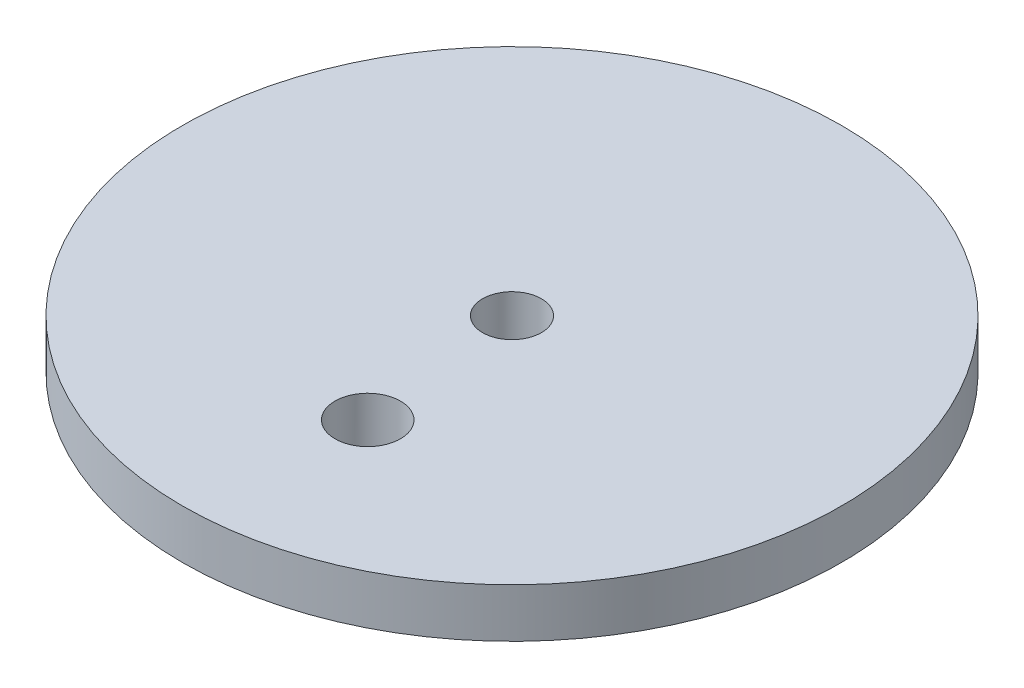
from build123d import *

# Parameters (mm, degrees)
SKETCH1_W          = 18.364886743
SKETCH1_H          = 3
SKETCH2_R          = 2.003106167
CUT_EXTRUDE1_DEPTH = 10


with BuildPart() as part:
    # Sketch1 → Revolve1 (revolve)
    with BuildSketch(Plane.XY, mode=Mode.PRIVATE) as revolve1_sk:
        with Locations((10.982443372, 7.898101992)):
            Rectangle(SKETCH1_W, SKETCH1_H)
    revolve(revolve1_sk.sketch.rotate(Axis((0, 9.398101992, 0), (0, -1, 0)), 270), axis=Axis((0, 9.398101992, 0), (0, -1, 0)))

    # Sketch2 → Cut-Extrude1 (cut)
    with BuildSketch(Plane(origin=(0, 9.398101992, 0), x_dir=(1, 0, 0), z_dir=(0, 1, 0))):
        with Locations(Location((1.10990846, -9.938214287, 0), (0, 0, 270))):
            Circle(SKETCH2_R)
    extrude(amount=-CUT_EXTRUDE1_DEPTH, mode=Mode.SUBTRACT)


solid = part.part
